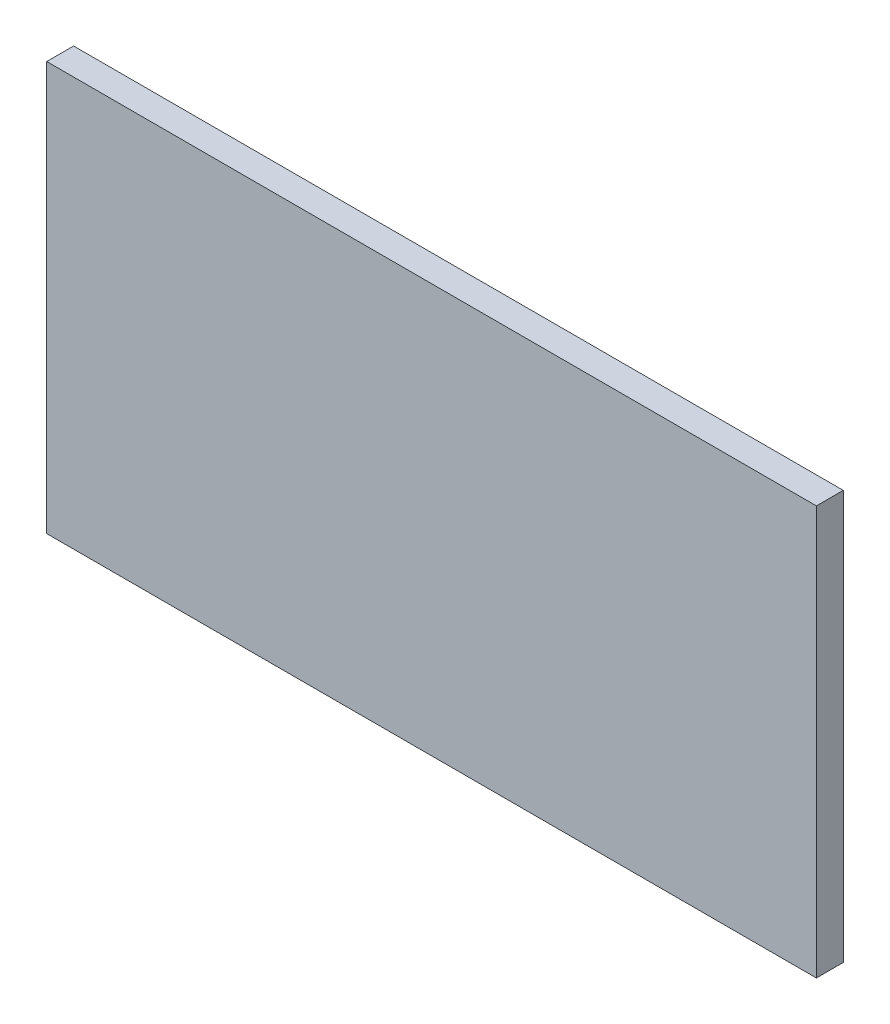
from build123d import *

# Parameters (mm, degrees)
SKETCH1_W           = 286.474271792
SKETCH1_H           = 152.18945689
BOSS_EXTRUDE1_DEPTH = 10


with BuildPart() as part:
    # Sketch1 → Boss-Extrude1 (new body)
    with BuildSketch(Plane.XY):
        Rectangle(SKETCH1_W, SKETCH1_H)
    extrude(amount=BOSS_EXTRUDE1_DEPTH)


solid = part.part
